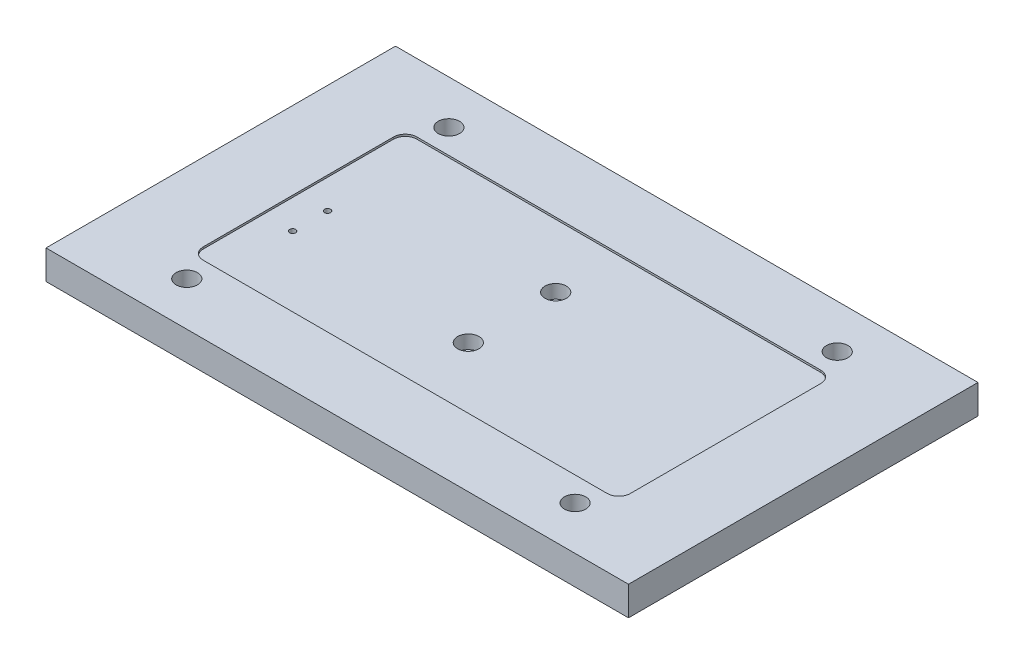
from build123d import *

# Parameters (mm, degrees)
SKETCH_1_W          = 300
SKETCH_1_H          = 180
EXTRUDE_1_DEPTH     = 15
SKETCH_2_R          = 3
SKETCH_2_R_2        = 2.5
CUT_EXTRUDE_1_DEPTH = 176.570498661
SKETCH_3_R          = 5.5
SKETCH_3_R_2        = 5
SKETCH_3_R_3        = 3
CUT_EXTRUDE_3_DEPTH = 8
CUT_EXTRUDE_4_DEPTH = 1
CUT_EXTRUDE_START   = -9
SKETCH_6_R          = 1.55
CUT_EXTRUDE_6_DEPTH = 9


with BuildPart() as part:
    # Эскиз1 → Бобышка-Вытянуть1 (new body)
    with BuildSketch(Plane(origin=(0, 0, 0), x_dir=(1, 0, 0), z_dir=(0, 1, 0))):
        Rectangle(SKETCH_1_W, SKETCH_1_H)
    extrude(amount=EXTRUDE_1_DEPTH)

    # Эскиз2 → Вырез-Вытянуть1 (cut, through all)
    # profile 1 of 12: a face of its own
    with BuildSketch(Plane(origin=(0, 15, 0), x_dir=(1, 0, 0), z_dir=(0, 1, 0))):
        with Locations(Location((0, -22.5, 0), (0, 0, 270))):
            Circle(SKETCH_2_R)
        with Locations((0, -22.5)):
            Circle(SKETCH_2_R_2, mode=Mode.SUBTRACT)
    # profile 2 of 12: a face of its own
    with BuildSketch(Plane(origin=(0, 15, 0), x_dir=(1, 0, 0), z_dir=(0, 1, 0))):
        with Locations((0, -22.5)):
            Circle(SKETCH_2_R_2)
    # profile 3 of 12: a face of its own
    with BuildSketch(Plane(origin=(0, 15, 0), x_dir=(1, 0, 0), z_dir=(0, 1, 0))):
        with Locations(Location((-100, -67.5, 0), (0, 0, 270))):
            Circle(SKETCH_2_R)
        with Locations((-100, -67.5)):
            Circle(SKETCH_2_R_2, mode=Mode.SUBTRACT)
    # profile 4 of 12: a face of its own
    with BuildSketch(Plane(origin=(0, 15, 0), x_dir=(1, 0, 0), z_dir=(0, 1, 0))):
        with Locations((-100, -67.5)):
            Circle(SKETCH_2_R_2)
    # profile 5 of 12: a face of its own
    with BuildSketch(Plane(origin=(0, 15, 0), x_dir=(1, 0, 0), z_dir=(0, 1, 0))):
        with Locations(Location((100, -67.5, 0), (0, 0, 270))):
            Circle(SKETCH_2_R)
        with Locations((100, -67.5)):
            Circle(SKETCH_2_R_2, mode=Mode.SUBTRACT)
    # profile 6 of 12: a face of its own
    with BuildSketch(Plane(origin=(0, 15, 0), x_dir=(1, 0, 0), z_dir=(0, 1, 0))):
        with Locations((100, -67.5)):
            Circle(SKETCH_2_R_2)
    # profile 7 of 12: a face of its own
    with BuildSketch(Plane(origin=(0, 15, 0), x_dir=(1, 0, 0), z_dir=(0, 1, 0))):
        with Locations(Location((100, 67.5, 0), (0, 0, 270))):
            Circle(SKETCH_2_R)
        with Locations((100, 67.5)):
            Circle(SKETCH_2_R_2, mode=Mode.SUBTRACT)
    # profile 8 of 12: a face of its own
    with BuildSketch(Plane(origin=(0, 15, 0), x_dir=(1, 0, 0), z_dir=(0, 1, 0))):
        with Locations((100, 67.5)):
            Circle(SKETCH_2_R_2)
    # profile 9 of 12: a face of its own
    with BuildSketch(Plane(origin=(0, 15, 0), x_dir=(1, 0, 0), z_dir=(0, 1, 0))):
        with Locations(Location((0, 22.5, 0), (0, 0, 270))):
            Circle(SKETCH_2_R)
        with Locations((0, 22.5)):
            Circle(SKETCH_2_R_2, mode=Mode.SUBTRACT)
    # profile 10 of 12: a face of its own
    with BuildSketch(Plane(origin=(0, 15, 0), x_dir=(1, 0, 0), z_dir=(0, 1, 0))):
        with Locations((0, 22.5)):
            Circle(SKETCH_2_R_2)
    # profile 11 of 12: a face of its own
    with BuildSketch(Plane(origin=(0, 15, 0), x_dir=(1, 0, 0), z_dir=(0, 1, 0))):
        with Locations(Location((-100, 67.5, 0), (0, 0, 270))):
            Circle(SKETCH_2_R)
        with Locations((-100, 67.5)):
            Circle(SKETCH_2_R_2, mode=Mode.SUBTRACT)
    # profile 12 of 12: a face of its own
    with BuildSketch(Plane(origin=(0, 15, 0), x_dir=(1, 0, 0), z_dir=(0, 1, 0))):
        with Locations((-100, 67.5)):
            Circle(SKETCH_2_R_2)
    extrude(amount=-CUT_EXTRUDE_1_DEPTH, mode=Mode.SUBTRACT)

    # Эскиз3 → Вырез-Вытянуть3 (cut)
    # profile 1 of 12: a face of its own
    with BuildSketch(Plane(origin=(0, 15, 0), x_dir=(1, 0, 0), z_dir=(0, 1, 0))):
        with Locations(Location((0, -22.5, 0), (0, 0, 270))):
            Circle(SKETCH_3_R)
        with Locations((0, -22.5)):
            Circle(SKETCH_3_R_2, mode=Mode.SUBTRACT)
    # profile 2 of 12: a face of its own
    with BuildSketch(Plane(origin=(0, 15, 0), x_dir=(1, 0, 0), z_dir=(0, 1, 0))):
        with Locations((0, -22.5)):
            Circle(SKETCH_3_R_2)
        with Locations(Location((0, -22.5, 0), (0, 0, 270))):
            Circle(SKETCH_3_R_3, mode=Mode.SUBTRACT)
    # profile 3 of 12: a face of its own
    with BuildSketch(Plane(origin=(0, 15, 0), x_dir=(1, 0, 0), z_dir=(0, 1, 0))):
        with Locations(Location((-100, -67.5, 0), (0, 0, 270))):
            Circle(SKETCH_3_R)
        with Locations((-100, -67.5)):
            Circle(SKETCH_3_R_2, mode=Mode.SUBTRACT)
    # profile 4 of 12: a face of its own
    with BuildSketch(Plane(origin=(0, 15, 0), x_dir=(1, 0, 0), z_dir=(0, 1, 0))):
        with Locations((-100, -67.5)):
            Circle(SKETCH_3_R_2)
        with Locations(Location((-100, -67.5, 0), (0, 0, 270))):
            Circle(SKETCH_3_R_3, mode=Mode.SUBTRACT)
    # profile 5 of 12: a face of its own
    with BuildSketch(Plane(origin=(0, 15, 0), x_dir=(1, 0, 0), z_dir=(0, 1, 0))):
        with Locations(Location((100, -67.5, 0), (0, 0, 270))):
            Circle(SKETCH_3_R)
        with Locations((100, -67.5)):
            Circle(SKETCH_3_R_2, mode=Mode.SUBTRACT)
    # profile 6 of 12: a face of its own
    with BuildSketch(Plane(origin=(0, 15, 0), x_dir=(1, 0, 0), z_dir=(0, 1, 0))):
        with Locations((100, -67.5)):
            Circle(SKETCH_3_R_2)
        with Locations(Location((100, -67.5, 0), (0, 0, 270))):
            Circle(SKETCH_3_R_3, mode=Mode.SUBTRACT)
    # profile 7 of 12: a face of its own
    with BuildSketch(Plane(origin=(0, 15, 0), x_dir=(1, 0, 0), z_dir=(0, 1, 0))):
        with Locations(Location((0, 22.5, 0), (0, 0, 270))):
            Circle(SKETCH_3_R)
        with Locations((0, 22.5)):
            Circle(SKETCH_3_R_2, mode=Mode.SUBTRACT)
    # profile 8 of 12: a face of its own
    with BuildSketch(Plane(origin=(0, 15, 0), x_dir=(1, 0, 0), z_dir=(0, 1, 0))):
        with Locations((0, 22.5)):
            Circle(SKETCH_3_R_2)
        with Locations(Location((0, 22.5, 0), (0, 0, 270))):
            Circle(SKETCH_3_R_3, mode=Mode.SUBTRACT)
    # profile 9 of 12: a face of its own
    with BuildSketch(Plane(origin=(0, 15, 0), x_dir=(1, 0, 0), z_dir=(0, 1, 0))):
        with Locations(Location((-100, 67.5, 0), (0, 0, 270))):
            Circle(SKETCH_3_R)
        with Locations((-100, 67.5)):
            Circle(SKETCH_3_R_2, mode=Mode.SUBTRACT)
    # profile 10 of 12: a face of its own
    with BuildSketch(Plane(origin=(0, 15, 0), x_dir=(1, 0, 0), z_dir=(0, 1, 0))):
        with Locations((-100, 67.5)):
            Circle(SKETCH_3_R_2)
        with Locations(Location((-100, 67.5, 0), (0, 0, 270))):
            Circle(SKETCH_3_R_3, mode=Mode.SUBTRACT)
    # profile 11 of 12: a face of its own
    with BuildSketch(Plane(origin=(0, 15, 0), x_dir=(1, 0, 0), z_dir=(0, 1, 0))):
        with Locations(Location((100, 67.5, 0), (0, 0, 270))):
            Circle(SKETCH_3_R)
        with Locations((100, 67.5)):
            Circle(SKETCH_3_R_2, mode=Mode.SUBTRACT)
    # profile 12 of 12: a face of its own
    with BuildSketch(Plane(origin=(0, 15, 0), x_dir=(1, 0, 0), z_dir=(0, 1, 0))):
        with Locations((100, 67.5)):
            Circle(SKETCH_3_R_2)
        with Locations(Location((100, 67.5, 0), (0, 0, 270))):
            Circle(SKETCH_3_R_3, mode=Mode.SUBTRACT)
    extrude(amount=-CUT_EXTRUDE_3_DEPTH, mode=Mode.SUBTRACT)

    # Эскиз4 → Вырез-Вытянуть4 (cut)
    with BuildSketch(Plane(origin=(0, 15, 0), x_dir=(1, 0, 0), z_dir=(0, 1, 0))):
        with BuildLine():
            Line((-110, -49), (-110, 49))
            ThreePointArc((-110, 49), (-108.242640687, 53.242640687), (-104, 55))
            Line((-104, 55), (104, 55))
            ThreePointArc((104, 55), (108.242640687, 53.242640687), (110, 49))
            Line((110, 49), (110, -49))
            ThreePointArc((110, -49), (108.242640687, -53.242640687), (104, -55))
            Line((104, -55), (-104, -55))
            ThreePointArc((-104, -55), (-108.242640687, -53.242640687), (-110, -49))
        make_face()
    extrude(amount=-CUT_EXTRUDE_4_DEPTH, mode=Mode.SUBTRACT)

    # Эскиз6 → Вырез-Вытянуть6 (cut)
    with BuildSketch(Plane(origin=(0, 14, 0), x_dir=(1, 0, 0), z_dir=(0, 1, 0)).offset(CUT_EXTRUDE_START)):
        with Locations(Location((-95, -18, 0), (0, 0, 270))):
            Circle(SKETCH_6_R)
        with Locations(Location((-95, 0, 0), (0, 0, 270))):
            Circle(SKETCH_6_R)
    extrude(amount=CUT_EXTRUDE_6_DEPTH, mode=Mode.SUBTRACT)


solid = part.part
